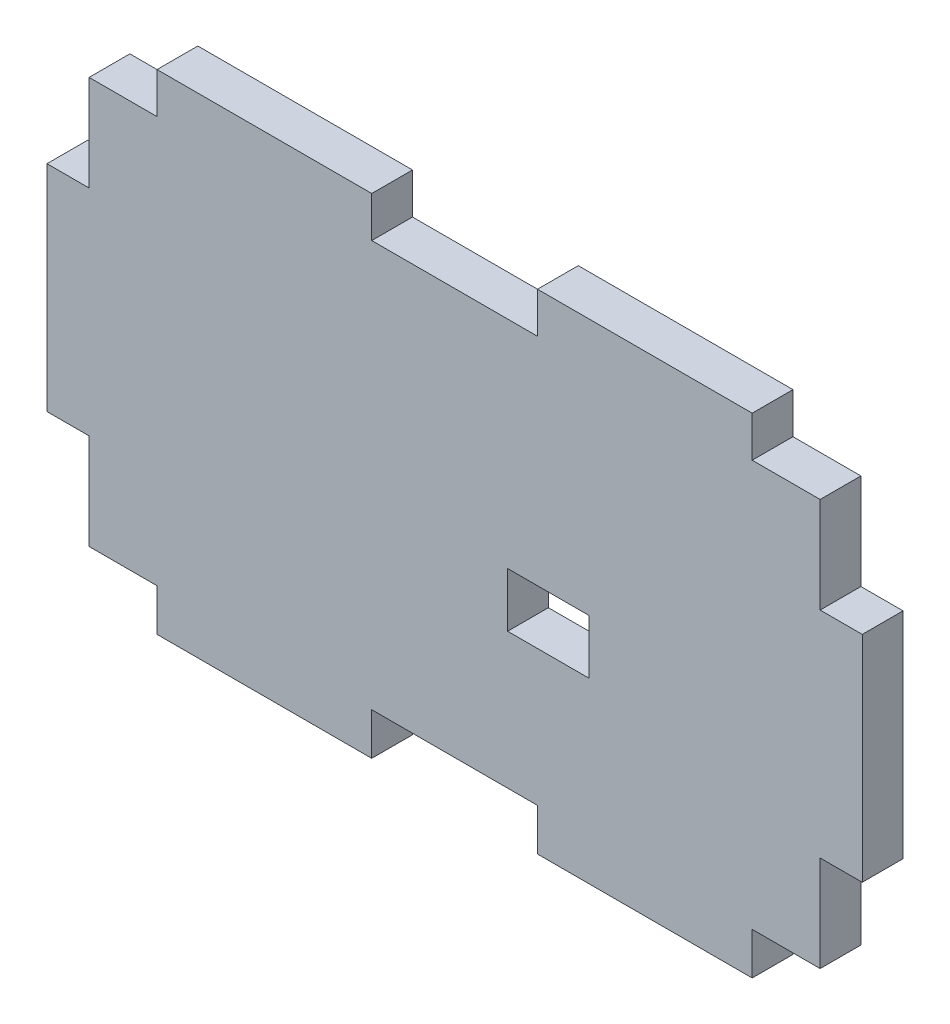
from build123d import *

# Parameters (mm, degrees)
SKETCH1_W           = 6
SKETCH1_H           = 4
BOSS_EXTRUDE1_DEPTH = 3


with BuildPart() as part:
    # Sketch1 → Boss-Extrude1 (new body)
    with BuildSketch(Plane.XY):
        Polygon((0, 29.9), (5, 29.9), (5, 32.9), (20.8, 32.9), (20.8, 29.9), (33, 29.9), (33, 32.9), (48.8, 32.9), (48.8, 29.9), (53.8, 29.9), (53.8, 22.85), (56.9, 22.85), (56.9, 7.05), (53.8, 7.05), (53.8, 0), (48.8, 0), (48.8, -3.1), (33, -3.1), (33, 0), (20.8, 0), (20.8, -3.1), (5, -3.1), (5, 0), (0, 0), (0, 7.05), (-3.1, 7.05), (-3.1, 22.85), (0, 22.85), align=None)
        with Locations((33.8, 12)):
            Rectangle(SKETCH1_W, SKETCH1_H, mode=Mode.SUBTRACT)
    extrude(amount=BOSS_EXTRUDE1_DEPTH)


solid = part.part
